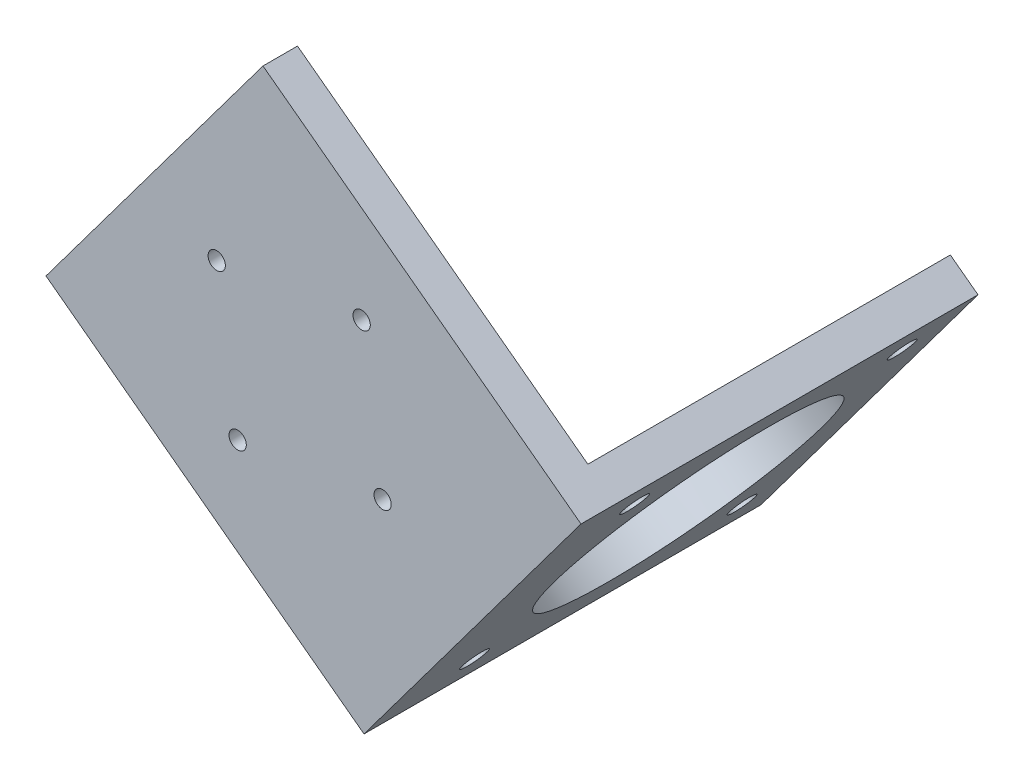
from build123d import *

# Parameters (mm, degrees)
SKETCH_2_R          = 1
EXTRUDE_1_DEPTH     = 4
SKETCH_5_W          = 42
SKETCH_5_H          = 4
EXTRUDE_2_DEPTH     = 4
EXTRUDE_3_DEPTH     = 42
CUT_EXTRUDE_1_REACH = 94.227
SKETCH_7_R          = 15.5
CUT_EXTRUDE_2_REACH = 94.227
SKETCH_9_R          = 1.5


with BuildPart() as part:
    # 草图2 → 凸台-拉伸1 (new body)
    with BuildSketch(Plane(origin=(0, 0, -18), x_dir=(-1, 0, 0), z_dir=(0, 0, -1))):
        Polygon((-4.251031416, -29.392664593), (29.392664593, -4.251031416), (4.251031416, 29.392664593), (-29.392664593, 4.251031416), align=None)
        with Locations((9.612484574, 7.183323765)):
            Circle(SKETCH_2_R, mode=Mode.SUBTRACT)
        with Locations((-7.183323765, 9.612484574)):
            Circle(SKETCH_2_R, mode=Mode.SUBTRACT)
        with Locations((-9.612484574, -7.183323765)):
            Circle(SKETCH_2_R, mode=Mode.SUBTRACT)
        with Locations((7.183323765, -9.612484574)):
            Circle(SKETCH_2_R, mode=Mode.SUBTRACT)
    extrude(amount=EXTRUDE_1_DEPTH)

    # 草图5 → 凸台-拉伸2 (add)
    with BuildSketch(Plane(origin=(16.821848005, -12.570816589, 0), x_dir=(0.5986103137395574, 0.8010403811822651, 0), z_dir=(0.8010403811822651, -0.5986103137395574, 0))):
        with Locations((0, -20)):
            Rectangle(SKETCH_5_W, SKETCH_5_H)
    extrude(amount=EXTRUDE_2_DEPTH)

    # 草图6 → 凸台-拉伸3 (add)
    with BuildSketch(Plane(origin=(0, 0, -22), x_dir=(-1, 0, 0), z_dir=(0, 0, -1))):
        Polygon((-7.455192941, -31.787105848), (-32.596826118, 1.856590161), (-29.392664593, 4.251031416), (-4.251031416, -29.392664593), align=None)
    extrude(amount=EXTRUDE_3_DEPTH)

    # 草图7 → 切除-拉伸1 (cut, up to next)
    with BuildSketch(Plane(origin=(20.02600953, -14.965257843, 0), x_dir=(-0.5986103137395574, -0.8010403811822653, 0), z_dir=(0.8010403811822653, -0.5986103137395574, 0)), mode=Mode.PRIVATE) as cut_extrude_1_sk1:
        with Locations(Location((0, 43, 0), (0, 0, 180))):
            Circle(SKETCH_7_R)
    cut_extrude_1_tool1 = extrude(cut_extrude_1_sk1.sketch, amount=-CUT_EXTRUDE_1_REACH, mode=Mode.PRIVATE) & part.part
    add(cut_extrude_1_tool1.solids().sort_by_distance((20.02601, -14.965258, -43))[0], mode=Mode.SUBTRACT)

    # 草图9 → 切除-拉伸2 (cut, up to next)
    with BuildSketch(Plane(origin=(20.02600953, -14.965257843, 0), x_dir=(-0.5986103137395573, -0.8010403811822652, 0), z_dir=(0.8010403811822653, -0.5986103137395574, 0)), mode=Mode.PRIVATE) as cut_extrude_2_sk1:
        with Locations(Location((-15.5, 58.5, 0), (0, 0, 180))):
            Circle(SKETCH_9_R)
    cut_extrude_2_tool1 = extrude(cut_extrude_2_sk1.sketch, amount=-CUT_EXTRUDE_2_REACH, mode=Mode.PRIVATE) & part.part
    # 草图9 → 切除-拉伸2 (cut, up to next)
    with BuildSketch(Plane(origin=(20.02600953, -14.965257843, 0), x_dir=(-0.5986103137395573, -0.8010403811822652, 0), z_dir=(0.8010403811822653, -0.5986103137395574, 0)), mode=Mode.PRIVATE) as cut_extrude_2_sk2:
        with Locations((-15.5, 27.5)):
            Circle(SKETCH_9_R)
    cut_extrude_2_tool2 = extrude(cut_extrude_2_sk2.sketch, amount=-CUT_EXTRUDE_2_REACH, mode=Mode.PRIVATE) & part.part
    # 草图9 → 切除-拉伸2 (cut, up to next)
    with BuildSketch(Plane(origin=(20.02600953, -14.965257843, 0), x_dir=(-0.5986103137395573, -0.8010403811822652, 0), z_dir=(0.8010403811822653, -0.5986103137395574, 0)), mode=Mode.PRIVATE) as cut_extrude_2_sk3:
        with Locations((15.5, 58.5)):
            Circle(SKETCH_9_R)
    cut_extrude_2_tool3 = extrude(cut_extrude_2_sk3.sketch, amount=-CUT_EXTRUDE_2_REACH, mode=Mode.PRIVATE) & part.part
    # 草图9 → 切除-拉伸2 (cut, up to next)
    with BuildSketch(Plane(origin=(20.02600953, -14.965257843, 0), x_dir=(-0.5986103137395573, -0.8010403811822652, 0), z_dir=(0.8010403811822653, -0.5986103137395574, 0)), mode=Mode.PRIVATE) as cut_extrude_2_sk4:
        with Locations(Location((15.5, 27.5, 0), (0, 0, 180))):
            Circle(SKETCH_9_R)
    cut_extrude_2_tool4 = extrude(cut_extrude_2_sk4.sketch, amount=-CUT_EXTRUDE_2_REACH, mode=Mode.PRIVATE) & part.part
    add(cut_extrude_2_tool1.solids().sort_by_distance((29.304469, -2.549132, -58.5))[0], mode=Mode.SUBTRACT)
    add(cut_extrude_2_tool2.solids().sort_by_distance((29.304469, -2.549132, -27.5))[0], mode=Mode.SUBTRACT)
    add(cut_extrude_2_tool3.solids().sort_by_distance((10.74755, -27.381384, -58.5))[0], mode=Mode.SUBTRACT)
    add(cut_extrude_2_tool4.solids().sort_by_distance((10.74755, -27.381384, -27.5))[0], mode=Mode.SUBTRACT)


solid = part.part
